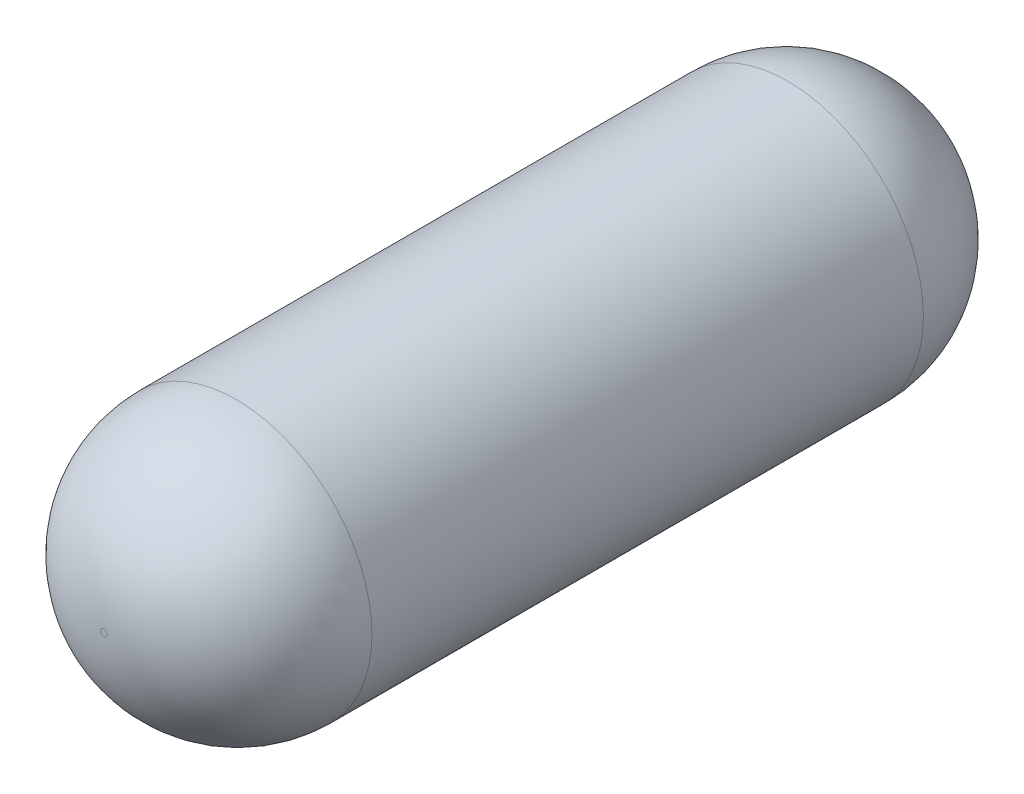
from build123d import *

# Parameters (mm, degrees)
SKETCH1_R           = 61.5
BOSS_EXTRUDE1_DEPTH = 370
FILLET1_R           = 60


with BuildPart() as part:
    # Sketch1 → Boss-Extrude1 (new body)
    with BuildSketch(Plane.XY):
        Circle(SKETCH1_R)
    extrude(amount=BOSS_EXTRUDE1_DEPTH)

    # Fillet1
    fillet1_edges = [part.edges().sort_by_distance(p)[0] for p in [
        (-61.5, 0, 0),
        (-61.5, 0, 370),
    ]]
    fillet(fillet1_edges, radius=FILLET1_R)


solid = part.part
